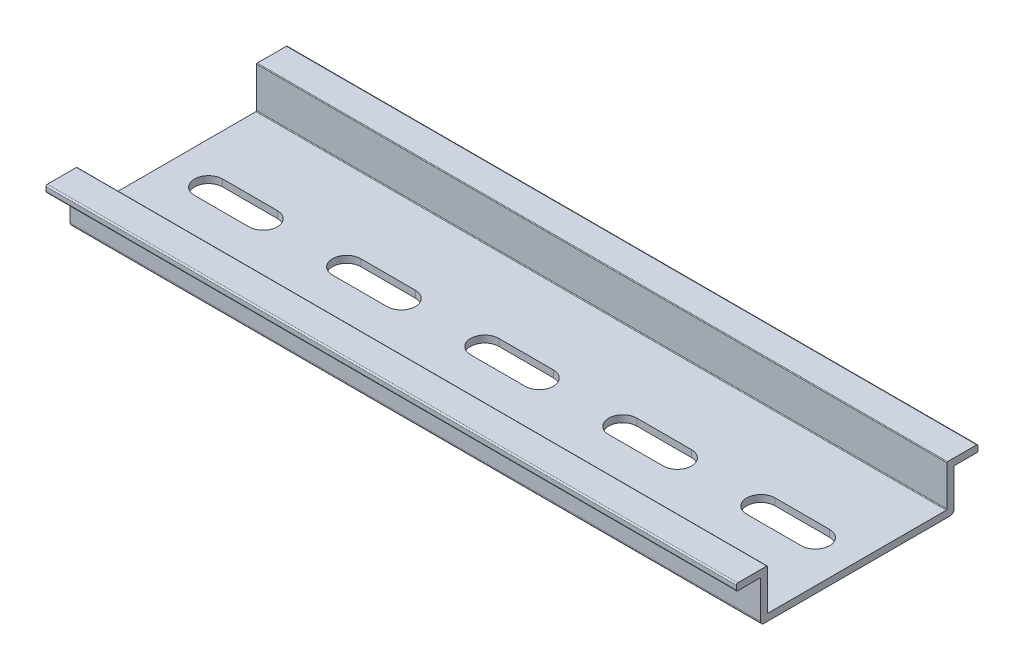
from build123d import *

# Parameters (mm, degrees)
PROFILE_DEPTH       = 50
SLOT_DEPTH          = 54.434539392
SLOTLP_COUNT        = 3
SLOTLP_PITCH        = 20
SLOTHP_COPY_1_DEPTH = 54.434539392
SLOTHP_COPY_2_DEPTH = 54.434539392
SLOTHP_COPY_3_DEPTH = 54.434539392


with BuildPart() as part:
    # ProfileS → Profile (new, symmetric)
    with BuildSketch(Plane(origin=(0, 0, 0), x_dir=(0, 0, -1), z_dir=(1, 0, 0))):
        with BuildLine():
            Line((-13.5, 0), (13.5, 0))
            ThreePointArc((13.5, 0), (13.853553391, 0.146446609), (14, 0.5))
            Line((14, 0.5), (14, 5.9))
            ThreePointArc((14, 5.9), (14.029289322, 5.970710678), (14.1, 6))
            Line((14.1, 6), (17.3, 6))
            ThreePointArc((17.3, 6), (17.441421356, 6.058578644), (17.5, 6.2))
            Line((17.5, 6.2), (17.5, 6.8))
            ThreePointArc((17.5, 6.8), (17.441421356, 6.941421356), (17.3, 7))
            Line((17.3, 7), (13.1, 7))
            ThreePointArc((13.1, 7), (13.029289322, 6.970710678), (13, 6.9))
            Line((13, 6.9), (13, 1.1))
            ThreePointArc((13, 1.1), (12.970710678, 1.029289322), (12.9, 1))
            Line((12.9, 1), (-12.9, 1))
            ThreePointArc((-12.9, 1), (-12.970710678, 1.029289322), (-13, 1.1))
            Line((-13, 1.1), (-13, 6.9))
            ThreePointArc((-13, 6.9), (-13.029289322, 6.970710678), (-13.1, 7))
            Line((-13.1, 7), (-17.3, 7))
            ThreePointArc((-17.3, 7), (-17.441421356, 6.941421356), (-17.5, 6.8))
            Line((-17.5, 6.8), (-17.5, 6.2))
            ThreePointArc((-17.5, 6.2), (-17.441421356, 6.058578644), (-17.3, 6))
            Line((-17.3, 6), (-14.1, 6))
            ThreePointArc((-14.1, 6), (-14.029289322, 5.970710678), (-14, 5.9))
            Line((-14, 5.9), (-14, 0.5))
            ThreePointArc((-14, 0.5), (-13.853553391, 0.146446609), (-13.5, 0))
        make_face()
    extrude(amount=PROFILE_DEPTH, both=True)

    # SlotS → Slot (cut, through all)
    with BuildSketch(Plane(origin=(0, 0, 0), x_dir=(1, 0, 0), z_dir=(0, 1, 0))):
        with BuildLine():
            Line((-3.95, 2.05), (3.95, 2.05))
            ThreePointArc((3.95, 2.05), (6, 0), (3.95, -2.05))
            Line((3.95, -2.05), (-3.95, -2.05))
            ThreePointArc((-3.95, -2.05), (-6, 0), (-3.95, 2.05))
        make_face()
    slot = extrude(amount=SLOT_DEPTH, mode=Mode.SUBTRACT)

    # SlotLP: Slot ×3
    with Locations(*[(-i * SLOTLP_PITCH, 0, 0) for i in range(1, SLOTLP_COUNT)]):
        add(slot, mode=Mode.SUBTRACT)

    # SlotHP copy 1 sketch → SlotHP copy 1 (cut, through all)
    with BuildSketch(Plane(origin=(20, 0, 0), x_dir=(-1, 0, 0), z_dir=(0, 1, 0))):
        with BuildLine():
            Line((-3.95, -2.05), (3.95, -2.05))
            ThreePointArc((3.95, -2.05), (6, 0), (3.95, 2.05))
            Line((3.95, 2.05), (-3.95, 2.05))
            ThreePointArc((-3.95, 2.05), (-6, 0), (-3.95, -2.05))
        make_face()
    extrude(amount=SLOTHP_COPY_1_DEPTH, mode=Mode.SUBTRACT)

    # SlotHP copy 2 sketch → SlotHP copy 2 (cut, through all)
    with BuildSketch(Plane(origin=(40, 0, 0), x_dir=(-1, 0, 0), z_dir=(0, 1, 0))):
        with BuildLine():
            Line((-3.95, -2.05), (3.95, -2.05))
            ThreePointArc((3.95, -2.05), (6, 0), (3.95, 2.05))
            Line((3.95, 2.05), (-3.95, 2.05))
            ThreePointArc((-3.95, 2.05), (-6, 0), (-3.95, -2.05))
        make_face()
    extrude(amount=SLOTHP_COPY_2_DEPTH, mode=Mode.SUBTRACT)

    # SlotHP copy 3 sketch → SlotHP copy 3 (cut, through all)
    with BuildSketch(Plane(origin=(0, 0, 0), x_dir=(-1, 0, 0), z_dir=(0, 1, 0))):
        with BuildLine():
            Line((-3.95, -2.05), (3.95, -2.05))
            ThreePointArc((3.95, -2.05), (6, 0), (3.95, 2.05))
            Line((3.95, 2.05), (-3.95, 2.05))
            ThreePointArc((-3.95, 2.05), (-6, 0), (-3.95, -2.05))
        make_face()
    extrude(amount=SLOTHP_COPY_3_DEPTH, mode=Mode.SUBTRACT)


solid = part.part
